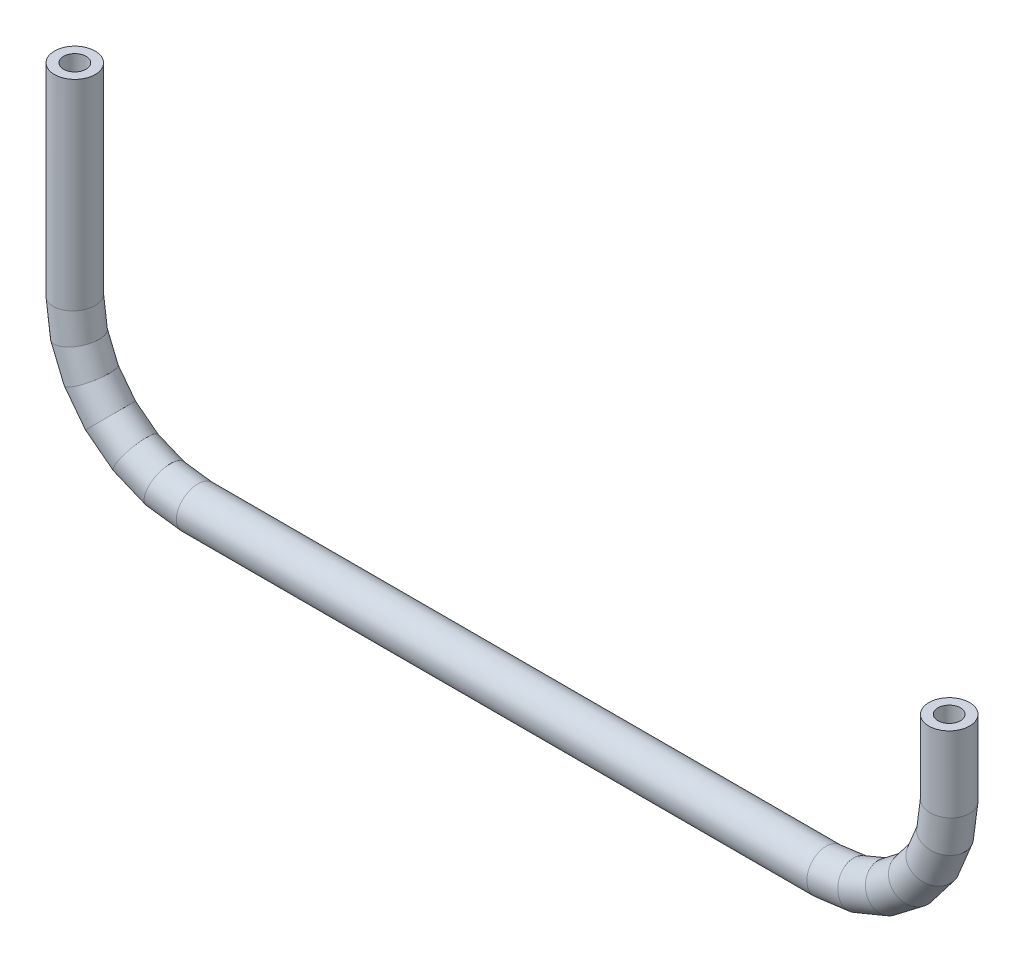
from build123d import *

# Parameters (mm, degrees)
PROFILE_R   = 1.5875
PROFILE_R_2 = 0.8775


with BuildPart() as part:
    # Tube: sweep along a curve in space
    with BuildLine() as tube_path:
        Line((-118.15, -19.9, 0), (-118.15, -35.6, 0))
        Line((-118.15, -35.6, 0), (-117.82629535, -38.058780928, 0))
        Line((-117.82629535, -38.058780928, 0), (-116.877241336, -40.35, 0))
        Line((-116.877241336, -40.35, 0), (-115.367514421, -42.317514421, 0))
        Line((-115.367514421, -42.317514421, 0), (-113.4, -43.827241336, 0))
        Line((-113.4, -43.827241336, 0), (-111.108780928, -44.77629535, 0))
        Line((-111.108780928, -44.77629535, 0), (-108.65, -45.1, 0))
        Line((-108.65, -45.1, 0), (-59.5, -45.1, 0))
        Line((-59.5, -45.1, 0), (-57.041219072, -44.77629535, 0))
        Line((-57.041219072, -44.77629535, 0), (-54.75, -43.827241336, 0))
        Line((-54.75, -43.827241336, 0), (-52.782485579, -42.317514421, 0))
        Line((-52.782485579, -42.317514421, 0), (-51.272758664, -40.35, 0))
        Line((-51.272758664, -40.35, 0), (-50.32370465, -38.058780928, 0))
        Line((-50.32370465, -38.058780928, 0), (-50, -35.6, 0))
        Line((-50, -35.6, 0), (-50, -29.8, 0))
    # Profile → Tube (sweep)
    with BuildSketch(Plane(origin=(0, -19.9, 0), x_dir=(1, 0, 0), z_dir=(0, 1, 0))):
        with Locations((-118.15, 0)):
            Circle(PROFILE_R)
        with Locations((-118.15, 0)):
            Circle(PROFILE_R_2, mode=Mode.SUBTRACT)
    sweep(path=tube_path.line, transition=Transition.RIGHT)


solid = part.part
